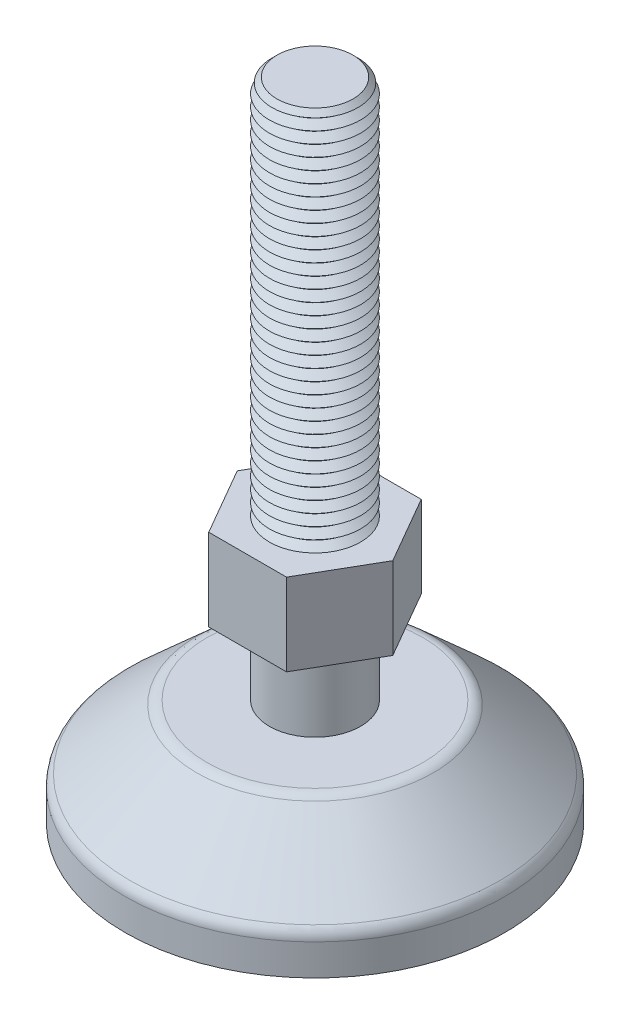
from build123d import *

# Parameters (mm, degrees)
SKETCH_6_R          = 14.593002621
CUT_EXTRUDE_2_DEPTH = 12


with BuildPart() as part:
    # 草图4 → 旋转2 (revolve)
    with BuildSketch(Plane.XY, mode=Mode.PRIVATE) as revolve_2_sk:
        with BuildLine():
            Line((0, 85), (0, 0))
            Line((0, 0), (25, 0))
            Line((25, 0), (25, 4.109275191))
            ThreePointArc((25, 4.109275191), (24.827000127, 4.92295236), (24.337929463, 5.595863483))
            Line((24.337929463, 5.595863483), (15.570457453, 13.486588292))
            ThreePointArc((15.570457453, 13.486588292), (14.949055524, 13.867240823), (14.23252799, 14))
            Line((14.23252799, 14), (6, 14))
            Line((6, 14), (6, 24.2))
            Line((6, 24.2), (10.235, 24.2))
            Line((10.235, 24.2), (10.235, 35))
            Line((10.235, 35), (6, 35))
            Line((6, 35), (5, 35.75155816))
            Line((5, 35.75155816), (6, 36.503116319))
            Line((6, 36.503116319), (5, 37.254674479))
            Line((5, 37.254674479), (6, 38.006232638))
            Line((6, 38.006232638), (5, 38.757790798))
            Line((5, 38.757790798), (6, 39.509348958))
            Line((6, 39.509348958), (5, 40.260907117))
            Line((5, 40.260907117), (6, 41.012465277))
            Line((6, 41.012465277), (5, 41.764023436))
            Line((5, 41.764023436), (6, 42.515581596))
            Line((6, 42.515581596), (5, 43.267139755))
            Line((5, 43.267139755), (6, 44.018697915))
            Line((6, 44.018697915), (5, 44.770256075))
            Line((5, 44.770256075), (6, 45.521814234))
            Line((6, 45.521814234), (5, 46.273372394))
            Line((5, 46.273372394), (6, 47.024930553))
            Line((6, 47.024930553), (5, 47.776488713))
            Line((5, 47.776488713), (6, 48.528046873))
            Line((6, 48.528046873), (5, 49.279605032))
            Line((5, 49.279605032), (6, 50.031163192))
            Line((6, 50.031163192), (5, 50.782721351))
            Line((5, 50.782721351), (6, 51.534279511))
            Line((6, 51.534279511), (5, 52.285837671))
            Line((5, 52.285837671), (6, 53.03739583))
            Line((6, 53.03739583), (5, 53.78895399))
            Line((5, 53.78895399), (6, 54.540512149))
            Line((6, 54.540512149), (5, 55.292070309))
            Line((5, 55.292070309), (6, 56.043628468))
            Line((6, 56.043628468), (5, 56.795186628))
            Line((5, 56.795186628), (6, 57.546744788))
            Line((6, 57.546744788), (5, 58.298302947))
            Line((5, 58.298302947), (6, 59.049861107))
            Line((6, 59.049861107), (5, 59.801419266))
            Line((5, 59.801419266), (6, 60.552977426))
            Line((6, 60.552977426), (5, 61.304535586))
            Line((5, 61.304535586), (6, 62.056093745))
            Line((6, 62.056093745), (5, 62.807651905))
            Line((5, 62.807651905), (6, 63.559210064))
            Line((6, 63.559210064), (5, 64.310768224))
            Line((5, 64.310768224), (6, 65.062326384))
            Line((6, 65.062326384), (5, 65.813884543))
            Line((5, 65.813884543), (6, 66.565442703))
            Line((6, 66.565442703), (5, 67.317000862))
            Line((5, 67.317000862), (6, 68.068559022))
            Line((6, 68.068559022), (5, 68.820117181))
            Line((5, 68.820117181), (6, 69.571675341))
            Line((6, 69.571675341), (5, 70.323233501))
            Line((5, 70.323233501), (6, 71.07479166))
            Line((6, 71.07479166), (5, 71.82634982))
            Line((5, 71.82634982), (6, 72.577907979))
            Line((6, 72.577907979), (5, 73.329466139))
            Line((5, 73.329466139), (6, 74.081024299))
            Line((6, 74.081024299), (5, 74.832582458))
            Line((5, 74.832582458), (6, 75.584140618))
            Line((6, 75.584140618), (5, 76.335698777))
            Line((5, 76.335698777), (6, 77.087256937))
            Line((6, 77.087256937), (5, 77.838815097))
            Line((5, 77.838815097), (6, 78.590373256))
            Line((6, 78.590373256), (5, 79.341931416))
            Line((5, 79.341931416), (6, 80.093489575))
            Line((6, 80.093489575), (5, 80.845047735))
            Line((5, 80.845047735), (6, 81.596605894))
            Line((6, 81.596605894), (5, 82.348164054))
            Line((5, 82.348164054), (6, 83.099722214))
            Line((6, 83.099722214), (5, 83.851280373))
            Line((5, 83.851280373), (5.655827282, 84.344172718))
            Line((5.655827282, 84.344172718), (5, 85))
            Line((5, 85), (0, 85))
        make_face()
    revolve(revolve_2_sk.sketch.rotate(Axis((0, 84.344172718, 0), (0, 1, 0)), 270), axis=Axis((0, 84.344172718, 0), (0, 1, 0)))

    # 草图6 → 切除-拉伸2 (cut)
    with BuildSketch(Plane(origin=(0, 35, 0), x_dir=(1, 0, 0), z_dir=(0, 1, 0))):
        Circle(SKETCH_6_R)
        Polygon((10.235, 0), (5.1175, 8.863770008), (-5.1175, 8.863770008), (-10.235, 0), (-5.1175, -8.863770008), (5.1175, -8.863770008), align=None, mode=Mode.SUBTRACT)
    extrude(amount=-CUT_EXTRUDE_2_DEPTH, mode=Mode.SUBTRACT)


solid = part.part
